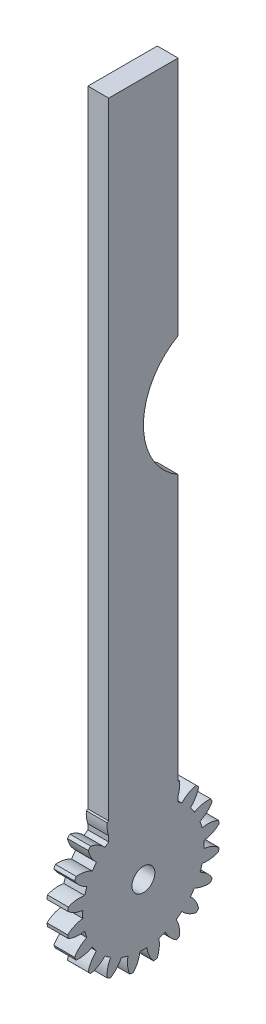
from build123d import *

# Parameters (mm, degrees)
BASPROSKE_W         = 3
BASPROSKE_H         = 11
TOOTHCUT_DEPTH      = 16.842979518
TEETHCUTS_COUNT     = 20
TEETHCUTS_ANGLE     = 342
BORSKE_R            = 2.5
BORE_DEPTH          = 50.0000508
SKETCH1_W           = 10
SKETCH1_H           = 100
BOSS_EXTRUDE1_DEPTH = 3
CUT_EXTRUDE1_DEPTH  = 3
CUT_EXTRUDE2_DEPTH  = 3
SKETCH6_R           = 2.5
SKETCH6_R_2         = 1.65
BOSS_EXTRUDE2_DEPTH = 3


with BuildPart() as part:
    # BasProSke → Base-Revolve (revolve)
    with BuildSketch(Plane(origin=(0, 0, 0), x_dir=(1, 0, 0), z_dir=(0, 1, 0)), mode=Mode.PRIVATE) as base_revolve_sk:
        with Locations((1.5, 5.5)):
            Rectangle(BASPROSKE_W, BASPROSKE_H)
    revolve(base_revolve_sk.sketch.rotate(Axis((-10, 0, 0), (1, 0, 0)), 180), axis=Axis((-10, 0, 0), (1, 0, 0)))

    # TooCutSke → ToothCut (cut, through all)
    with BuildSketch(Plane(origin=(0, 0, 0), x_dir=(0, 0, -1), z_dir=(1, 0, 0))):
        with BuildLine():
            ThreePointArc((0.499924007, 8.734705318), (0, 8.749), (-0.499924007, 8.734705318))
            ThreePointArc((-0.499924007, 8.734705318), (-0.824302243, 9.905497836), (-1.485192705, 10.924909509))
            ThreePointArc((-1.485192705, 10.924909509), (0, 11.0254), (1.485192705, 10.924909509))
            ThreePointArc((1.485192705, 10.924909509), (0.824302243, 9.905497836), (0.499924007, 8.734705318))
        make_face()
    toothcut = extrude(amount=TOOTHCUT_DEPTH, mode=Mode.SUBTRACT)

    # TeethCuts: ToothCut ×20 about axis
    teethcuts_axis = Axis((-10, 0, 0), (1, 0, 0))
    for i in range(1, TEETHCUTS_COUNT):
        add(toothcut.rotate(teethcuts_axis, i * TEETHCUTS_ANGLE / (TEETHCUTS_COUNT - 1)), mode=Mode.SUBTRACT)

    # BorSke → Bore (cut, symmetric)
    with BuildSketch(Plane(origin=(0, 0, 0), x_dir=(0, 0, -1), z_dir=(1, 0, 0))):
        with Locations(Location((0, 0, 0), (0, 0, 180))):
            Circle(BORSKE_R)
    extrude(amount=BORE_DEPTH, both=True, mode=Mode.SUBTRACT)

    # Sketch1 → Boss-Extrude1 (add)
    with BuildSketch(Plane(origin=(3, 0, 0), x_dir=(0, 0, -1), z_dir=(1, 0, 0))):
        with Locations((0, 50)):
            Rectangle(SKETCH1_W, SKETCH1_H)
    extrude(amount=-BOSS_EXTRUDE1_DEPTH)

    # Sketch4 → Cut-Extrude1 (cut)
    with BuildSketch(Plane(origin=(3, 0, 0), x_dir=(0, 0, -1), z_dir=(1, 0, 0))):
        with BuildLine():
            Line((5, 65.352905548), (5, 48.032397472))
            ThreePointArc((5, 48.032397472), (0, 56.69265151), (5, 65.352905548))
        make_face()
    extrude(amount=-CUT_EXTRUDE1_DEPTH, mode=Mode.SUBTRACT)

    # Sketch5 → Cut-Extrude2 (cut)
    with BuildSketch(Plane(origin=(3, 0, 0), x_dir=(0, 0, -1), z_dir=(1, 0, 0))):
        with BuildLine():
            Line((2.5, 0), (-2.5, 0))
            ThreePointArc((-2.5, 0), (0, 2.5), (2.5, 0))
        make_face()
    extrude(amount=-CUT_EXTRUDE2_DEPTH, mode=Mode.SUBTRACT)

    # Sketch6 → Boss-Extrude2 (add)
    with BuildSketch(Plane(origin=(3, 0, 0), x_dir=(0, 0, -1), z_dir=(1, 0, 0))):
        Circle(SKETCH6_R)
        Circle(SKETCH6_R_2, mode=Mode.SUBTRACT)
    extrude(amount=-BOSS_EXTRUDE2_DEPTH)


solid = part.part
